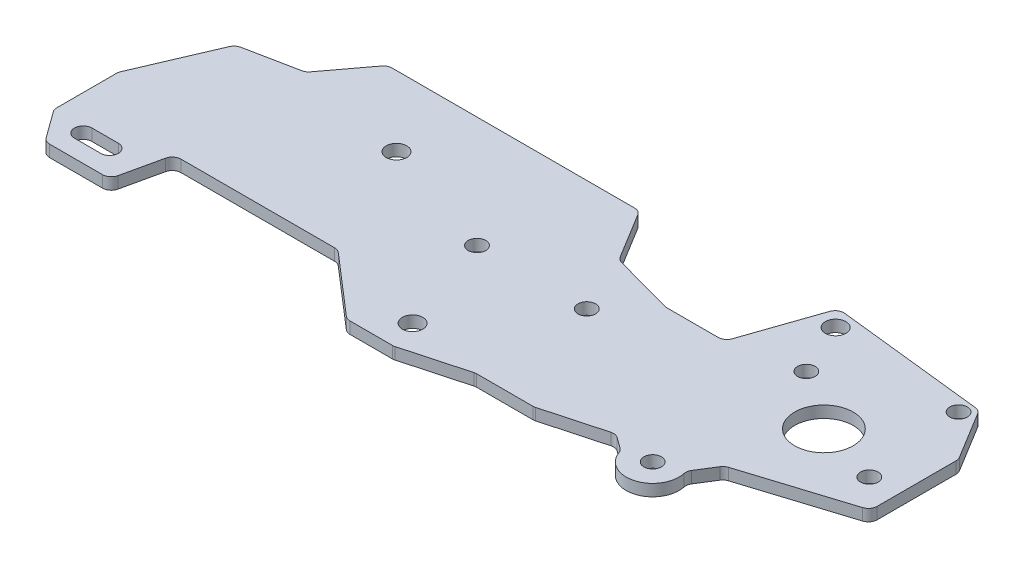
from build123d import *

# Parameters (mm, degrees)
SKETCH1_R           = 1.75
SKETCH1_R_2         = 1.5
SKETCH1_R_3         = 5
BOSS_EXTRUDE1_DEPTH = 2
FILLET1_R           = 1.5


with BuildPart() as part:
    # Sketch1 → Boss-Extrude1 (new body)
    with BuildSketch(Plane(origin=(0, 0, 0), x_dir=(1, 0, 0), z_dir=(0, 1, 0))):
        with BuildLine():
            Line((0, 0), (43, 0))
            Line((43, 0), (48.5, -9))
            Line((48.5, -9), (59.5, -12))
            Line((59.5, -12), (69.5, -12))
            Line((69.5, -12), (74.5, 2.5))
            Line((74.5, 2.5), (101.5, -0.5))
            Line((101.5, -0.5), (107, -9.5))
            Line((107, -9.5), (107, -24.5))
            Line((107, -24.5), (88, -30.5))
            Line((88, -30.5), (85.5, -34.5))
            ThreePointArc((85.5, -34.5), (82.533474843, -40.320323174), (76.870377201, -37.063674828))
            Line((76.870377201, -37.063674828), (74, -35))
            Line((74, -35), (63, -38))
            Line((63, -38), (53, -38))
            Line((53, -38), (42, -41))
            Line((42, -41), (34, -41))
            Line((34, -41), (23, -31.5))
            Line((23, -31.5), (-5, -31.5))
            Line((-5, -31.5), (-7, -40.5))
            Line((-7, -40.5), (-18, -40.5))
            Line((-18, -40.5), (-22, -35))
            Line((-22, -35), (-22, -24))
            Line((-22, -24), (-16, -10))
            Line((-16, -10), (-6, -8))
            Line((-6, -8), (0, 0))
        make_face()
        with Locations(Location((40.25, -36, 0), (0, 0, 270))):
            Circle(SKETCH1_R, mode=Mode.SUBTRACT)
        with Locations(Location((81.25, -36, 0), (0, 0, 270))):
            Circle(SKETCH1_R_2, mode=Mode.SUBTRACT)
        with Locations(Location((91, -16.5, 0), (0, 0, 270))):
            Circle(SKETCH1_R_3, mode=Mode.SUBTRACT)
        with Locations(Location((77, -0.5, 0), (0, 0, 270))):
            Circle(SKETCH1_R, mode=Mode.SUBTRACT)
        with Locations(Location((81, -9.5, 0), (0, 0, 270))):
            Circle(SKETCH1_R_2, mode=Mode.SUBTRACT)
        with Locations(Location((100, -2.5, 0), (0, 0, 270))):
            Circle(SKETCH1_R_2, mode=Mode.SUBTRACT)
        with Locations(Location((102, -19.75, 0), (0, 0, 270))):
            Circle(SKETCH1_R_2, mode=Mode.SUBTRACT)
        with Locations(Location((53, -19, 0), (0, 0, 270))):
            Circle(SKETCH1_R_2, mode=Mode.SUBTRACT)
        with Locations(Location((34.25, -19, 0), (0, 0, 270))):
            Circle(SKETCH1_R_2, mode=Mode.SUBTRACT)
        with Locations(Location((13.5, -12, 0), (0, 0, 270))):
            Circle(SKETCH1_R, mode=Mode.SUBTRACT)
        with BuildLine():
            Line((-16, -34.5), (-11.5, -34.5))
            ThreePointArc((-11.5, -34.5), (-10, -36), (-11.5, -37.5))
            Line((-11.5, -37.5), (-16, -37.5))
            ThreePointArc((-16, -37.5), (-17.5, -36), (-16, -34.5))
        make_face(mode=Mode.SUBTRACT)
    extrude(amount=BOSS_EXTRUDE1_DEPTH)

    # Fillet1
    fillet1_edges = [part.edges().sort_by_distance(p)[0] for p in [
        (0, 1, 0),
        (43, 1, 0),
        (48.5, 1, 9),
        (59.5, 1, 12),
        (69.5, 1, 12),
        (74.5, 1, -2.5),
        (101.5, 1, 0.5),
        (107, 1, 9.5),
        (107, 1, 24.5),
        (88, 1, 30.5),
        (85.5, 1, 34.5),
        (76.870377201, 1, 37.063674828),
        (74, 1, 35),
        (63, 1, 38),
        (53, 1, 38),
        (42, 1, 41),
        (34, 1, 41),
        (23, 1, 31.5),
        (-5, 1, 31.5),
        (-7, 1, 40.5),
        (-18, 1, 40.5),
        (-22, 1, 35),
        (-22, 1, 24),
        (-16, 1, 10),
        (-6, 1, 8),
    ]]
    fillet(fillet1_edges, radius=FILLET1_R)


solid = part.part
